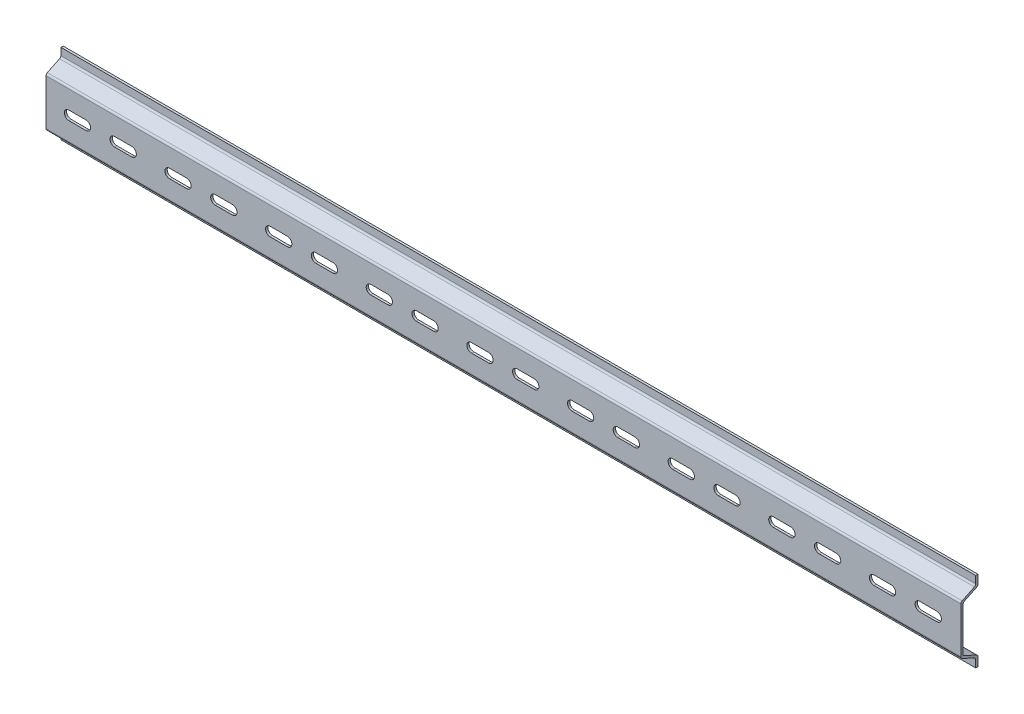
from build123d import *

# Parameters (mm, degrees)
EXTRUDE_1_DEPTH     = 400
FILLET_1_R          = 1
CUT_EXTRUDE_1_DEPTH = 10


with BuildPart() as part:
    # 草图1 → 凸台-拉伸1 (new body)
    with BuildSketch(Plane(origin=(0, 0, 0), x_dir=(0, 0, -1), z_dir=(1, 0, 0))):
        Polygon((0, -10), (0, 10), (6.5, 13.120839269), (6.5, 17.5), (5.5, 17.5), (5.5, 13.75), (-1, 10.629160731), (-1, -10.629160731), (5.5, -13.75), (5.5, -17.5), (6.5, -17.5), (6.5, -13.120839269), align=None)
    extrude(amount=EXTRUDE_1_DEPTH)

    # 圆角1
    fillet_1_edges = [part.edges().sort_by_distance(p)[0] for p in [
        (200, 10, 0),
        (200, -13.120839269, -6.5),
        (200, -13.75, -5.5),
        (200, -10.629160731, 1),
        (200, 10.629160731, 1),
        (200, 13.75, -5.5),
        (200, 13.120839269, -6.5),
    ]]
    fillet(fillet_1_edges, radius=FILLET_1_R)

    # 草图2 → 切除-拉伸1 (cut)
    with BuildSketch(Plane(origin=(0, 0, 0), x_dir=(-1, 0, 0), z_dir=(0, 0, -1))):
        with BuildLine():
            Line((-10, -2), (-17.5, -2))
            ThreePointArc((-17.5, -2), (-19.5, 0), (-17.5, 2))
            Line((-17.5, 2), (-10, 2))
            ThreePointArc((-10, 2), (-8, 0), (-10, -2))
        make_face()
        with BuildLine():
            Line((-30, -2), (-37.5, -2))
            ThreePointArc((-37.5, -2), (-39.5, 0), (-37.5, 2))
            Line((-37.5, 2), (-30, 2))
            ThreePointArc((-30, 2), (-28, 0), (-30, -2))
        make_face()
        with BuildLine():
            Line((-54, -2), (-61.5, -2))
            ThreePointArc((-61.5, -2), (-63.5, 0), (-61.5, 2))
            Line((-61.5, 2), (-54, 2))
            ThreePointArc((-54, 2), (-52, 0), (-54, -2))
        make_face()
        with BuildLine():
            Line((-74, -2), (-81.5, -2))
            ThreePointArc((-81.5, -2), (-83.5, 0), (-81.5, 2))
            Line((-81.5, 2), (-74, 2))
            ThreePointArc((-74, 2), (-72, 0), (-74, -2))
        make_face()
        with BuildLine():
            Line((-98, -2), (-105.5, -2))
            ThreePointArc((-105.5, -2), (-107.5, 0), (-105.5, 2))
            Line((-105.5, 2), (-98, 2))
            ThreePointArc((-98, 2), (-96, 0), (-98, -2))
        make_face()
        with BuildLine():
            Line((-118, -2), (-125.5, -2))
            ThreePointArc((-125.5, -2), (-127.5, 0), (-125.5, 2))
            Line((-125.5, 2), (-118, 2))
            ThreePointArc((-118, 2), (-116, 0), (-118, -2))
        make_face()
        with BuildLine():
            Line((-142, -2), (-149.5, -2))
            ThreePointArc((-149.5, -2), (-151.5, 0), (-149.5, 2))
            Line((-149.5, 2), (-142, 2))
            ThreePointArc((-142, 2), (-140, 0), (-142, -2))
        make_face()
        with BuildLine():
            Line((-162, -2), (-169.5, -2))
            ThreePointArc((-169.5, -2), (-171.5, 0), (-169.5, 2))
            Line((-169.5, 2), (-162, 2))
            ThreePointArc((-162, 2), (-160, 0), (-162, -2))
        make_face()
        with BuildLine():
            Line((-186, -2), (-193.5, -2))
            ThreePointArc((-193.5, -2), (-195.5, 0), (-193.5, 2))
            Line((-193.5, 2), (-186, 2))
            ThreePointArc((-186, 2), (-184, 0), (-186, -2))
        make_face()
        with BuildLine():
            Line((-206, -2), (-213.5, -2))
            ThreePointArc((-213.5, -2), (-215.5, 0), (-213.5, 2))
            Line((-213.5, 2), (-206, 2))
            ThreePointArc((-206, 2), (-204, 0), (-206, -2))
        make_face()
        with BuildLine():
            Line((-230, -2), (-237.5, -2))
            ThreePointArc((-237.5, -2), (-239.5, 0), (-237.5, 2))
            Line((-237.5, 2), (-230, 2))
            ThreePointArc((-230, 2), (-228, 0), (-230, -2))
        make_face()
        with BuildLine():
            Line((-250, -2), (-257.5, -2))
            ThreePointArc((-257.5, -2), (-259.5, 0), (-257.5, 2))
            Line((-257.5, 2), (-250, 2))
            ThreePointArc((-250, 2), (-248, 0), (-250, -2))
        make_face()
        with BuildLine():
            Line((-274, -2), (-281.5, -2))
            ThreePointArc((-281.5, -2), (-283.5, 0), (-281.5, 2))
            Line((-281.5, 2), (-274, 2))
            ThreePointArc((-274, 2), (-272, 0), (-274, -2))
        make_face()
        with BuildLine():
            Line((-294, -2), (-301.5, -2))
            ThreePointArc((-301.5, -2), (-303.5, 0), (-301.5, 2))
            Line((-301.5, 2), (-294, 2))
            ThreePointArc((-294, 2), (-292, 0), (-294, -2))
        make_face()
        with BuildLine():
            Line((-318, -2), (-325.5, -2))
            ThreePointArc((-325.5, -2), (-327.5, 0), (-325.5, 2))
            Line((-325.5, 2), (-318, 2))
            ThreePointArc((-318, 2), (-316, 0), (-318, -2))
        make_face()
        with BuildLine():
            Line((-338, -2), (-345.5, -2))
            ThreePointArc((-345.5, -2), (-347.5, 0), (-345.5, 2))
            Line((-345.5, 2), (-338, 2))
            ThreePointArc((-338, 2), (-336, 0), (-338, -2))
        make_face()
        with BuildLine():
            Line((-362, -2), (-369.5, -2))
            ThreePointArc((-369.5, -2), (-371.5, 0), (-369.5, 2))
            Line((-369.5, 2), (-362, 2))
            ThreePointArc((-362, 2), (-360, 0), (-362, -2))
        make_face()
        with BuildLine():
            Line((-382, -2), (-389.5, -2))
            ThreePointArc((-389.5, -2), (-391.5, 0), (-389.5, 2))
            Line((-389.5, 2), (-382, 2))
            ThreePointArc((-382, 2), (-380, 0), (-382, -2))
        make_face()
    extrude(amount=-CUT_EXTRUDE_1_DEPTH, mode=Mode.SUBTRACT)


solid = part.part
